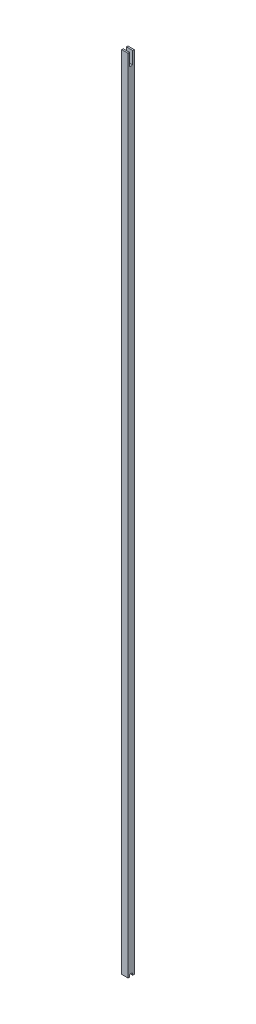
from build123d import *

# Parameters (mm, degrees)
BOSS_EXTRUDE1_DEPTH = 6.35


with BuildPart() as part:
    # Sketch1 → Boss-Extrude1 (new body)
    with BuildSketch(Plane(origin=(0, 0, 0), x_dir=(0, 0, -1), z_dir=(1, 0, 0))):
        Polygon((0, 0), (1.5875, 0), (1.5875, 2.38125), (4.7625, 2.38125), (4.7625, 0), (6.35, 0), (6.35, 812.8), (4.7625, 812.8), (4.7625, 800.1), (1.5875, 800.1), (1.5875, 812.8), (0, 812.8), align=None)
    extrude(amount=BOSS_EXTRUDE1_DEPTH)


solid = part.part
